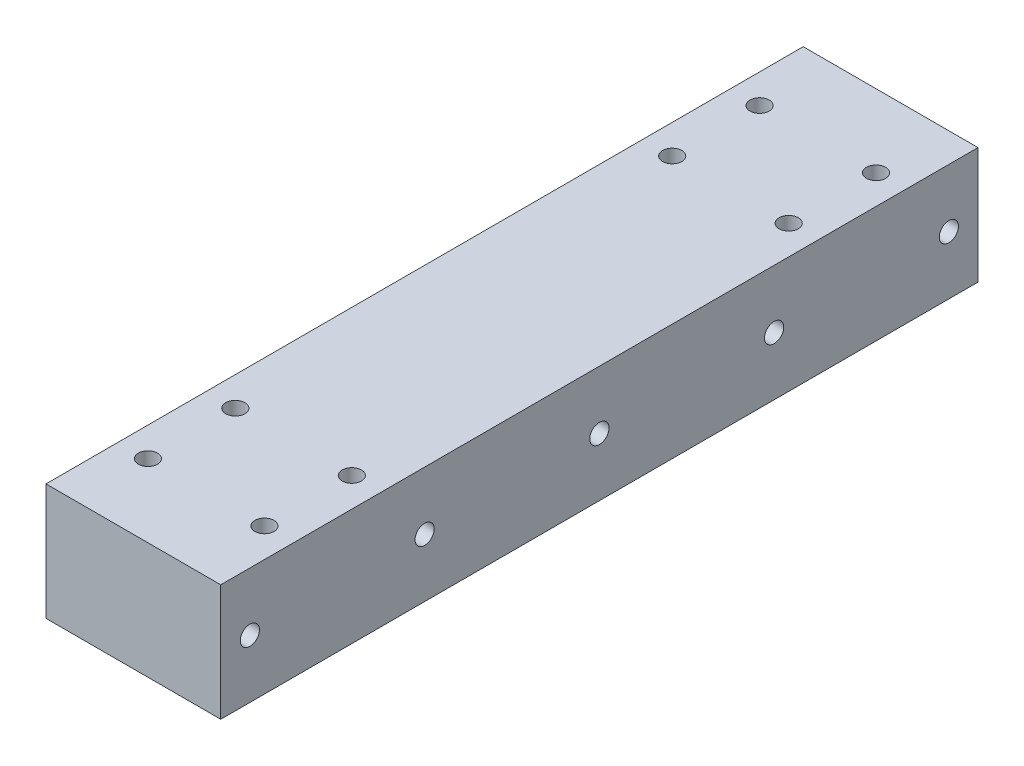
from build123d import *

# Parameters (mm, degrees)
ESQUISSE1_W             = 30
ESQUISSE1_H             = 20
BOSS_EXTRU_1_DEPTH      = 130
ESQUISSE2_R             = 1.65
ENL_V_MAT_EXTRU_1_DEPTH = 135.907375632
ESQUISSE3_R             = 1.65
ENL_V_MAT_EXTRU_2_DEPTH = 135.907375632


with BuildPart() as part:
    # Esquisse1 → Boss.-Extru.1 (new body)
    with BuildSketch(Plane.XY):
        with Locations((15, 10)):
            Rectangle(ESQUISSE1_W, ESQUISSE1_H)
    extrude(amount=BOSS_EXTRU_1_DEPTH)

    # Esquisse2 → Enlèv. mat.-Extru.1 (cut, through all)
    with BuildSketch(Plane(origin=(0, 20, 0), x_dir=(1, 0, 0), z_dir=(0, 1, 0))):
        with Locations(Location((5, -117.5, 0), (0, 0, 270))):
            Circle(ESQUISSE2_R)
        with Locations(Location((5, -102.5, 0), (0, 0, 90))):
            Circle(ESQUISSE2_R)
        with Locations(Location((25, -102.5, 0), (0, 0, 270))):
            Circle(ESQUISSE2_R)
        with Locations(Location((25, -117.5, 0), (0, 0, 90))):
            Circle(ESQUISSE2_R)
        with Locations(Location((25, -12.5, 0), (0, 0, 270))):
            Circle(ESQUISSE2_R)
        with Locations(Location((25, -27.5, 0), (0, 0, 90))):
            Circle(ESQUISSE2_R)
        with Locations(Location((5, -27.5, 0), (0, 0, 270))):
            Circle(ESQUISSE2_R)
        with Locations(Location((5, -12.5, 0), (0, 0, 90))):
            Circle(ESQUISSE2_R)
    extrude(amount=-ENL_V_MAT_EXTRU_1_DEPTH, mode=Mode.SUBTRACT)

    # Esquisse3 → Enlèv. mat.-Extru.2 (cut, through all)
    with BuildSketch(Plane(origin=(30, 0, 0), x_dir=(0, 0, -1), z_dir=(1, 0, 0))):
        with Locations((-65, 10)):
            Circle(ESQUISSE3_R)
        with Locations((-95, 10)):
            Circle(ESQUISSE3_R)
        with Locations((-125, 10)):
            Circle(ESQUISSE3_R)
        with Locations(Location((-5, 10, 0), (0, 0, 180))):
            Circle(ESQUISSE3_R)
        with Locations(Location((-35, 10, 0), (0, 0, 180))):
            Circle(ESQUISSE3_R)
    extrude(amount=-ENL_V_MAT_EXTRU_2_DEPTH, mode=Mode.SUBTRACT)


solid = part.part
